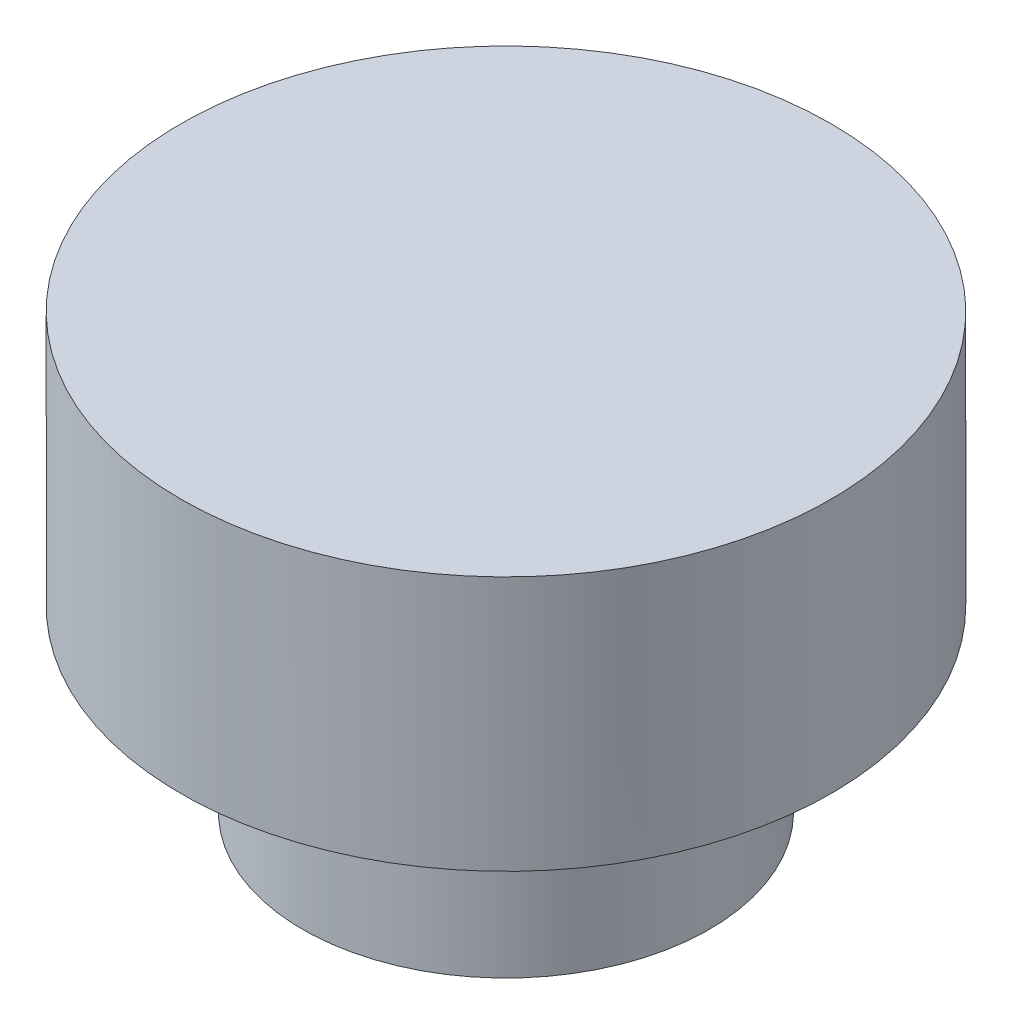
from build123d import *

# Parameters (mm, degrees)
SKETCH1_R           = 12.75
BOSS_EXTRUDE1_DEPTH = 17
SKETCH2_R           = 12.75
SKETCH2_R_2         = 7.975
CUT_EXTRUDE1_DEPTH  = 7


with BuildPart() as part:
    # Sketch1 → Boss-Extrude1 (new body)
    with BuildSketch(Plane(origin=(0, 0, 0), x_dir=(1, 0, 0), z_dir=(0, 1, 0))):
        with Locations(Location((0, 0, 0), (0, 0, 270))):
            Circle(SKETCH1_R)
    extrude(amount=BOSS_EXTRUDE1_DEPTH)

    # Sketch2 → Cut-Extrude1 (cut)
    with BuildSketch(Plane.XZ):
        with Locations(Location((0, 0, 0), (0, 0, 270))):
            Circle(SKETCH2_R)
        with Locations(Location((0, 0, 0), (0, 0, 270))):
            Circle(SKETCH2_R_2, mode=Mode.SUBTRACT)
    extrude(amount=-CUT_EXTRUDE1_DEPTH, mode=Mode.SUBTRACT)


solid = part.part
